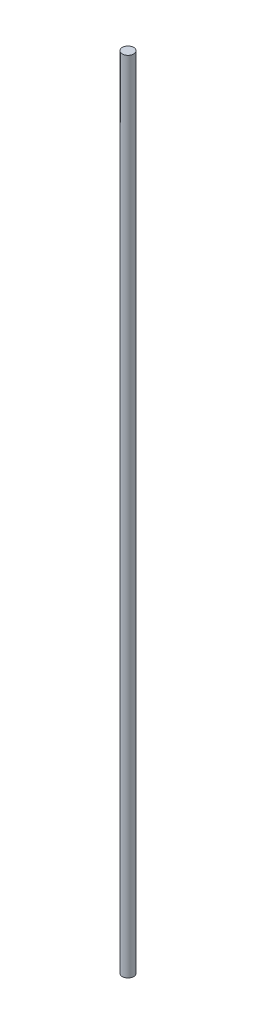
from build123d import *

# Parameters (mm, degrees)
BOSS_EXTRUDE1_DEPTH      = 175
BOSS_EXTRUDE1_DEPTH_BACK = 175
SKETCH1_R                = 2.5


with BuildPart() as part:
    # Sketch1 → Boss-Extrude1 (new, two sides: drawn at the far end of the back side and taken through both)
    with BuildSketch(Plane(origin=(0, 0, 0), x_dir=(1, 0, 0), z_dir=(0, 1, 0)).offset(-BOSS_EXTRUDE1_DEPTH_BACK)):
        Circle(SKETCH1_R)
    extrude(amount=BOSS_EXTRUDE1_DEPTH + BOSS_EXTRUDE1_DEPTH_BACK)


solid = part.part
